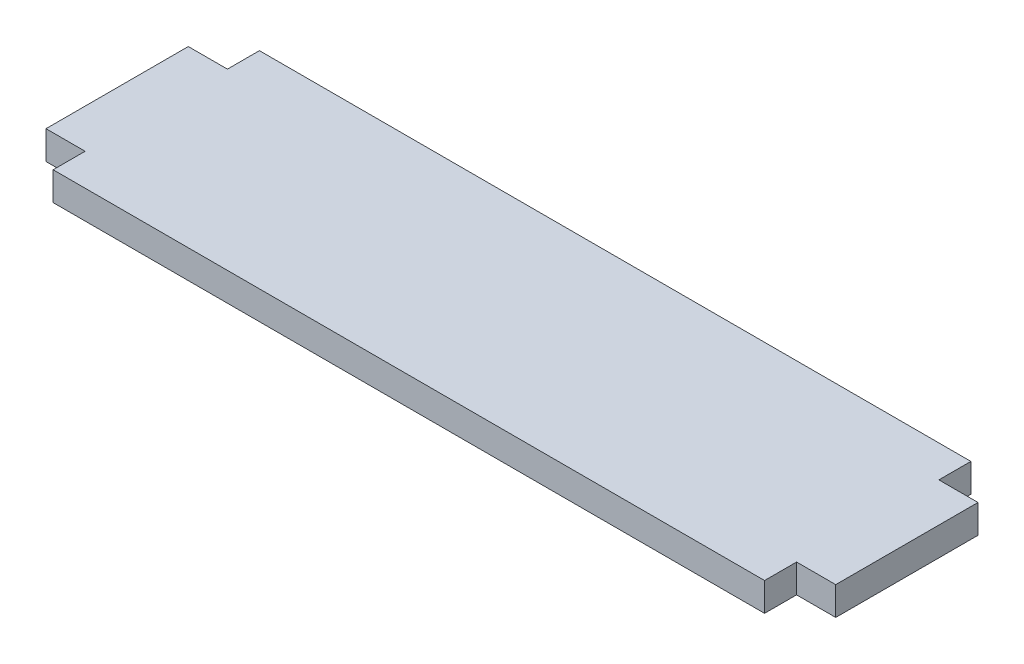
from build123d import *

# Parameters (mm, degrees)
SKETCH_1_W      = 99.99997774
SKETCH_1_H      = 28.996988848
EXTRUDE_1_DEPTH = 4
SKETCH_2_W      = 20
SKETCH_2_H      = 4
EXTRUDE_2_DEPTH = 5.5


with BuildPart() as part:
    # Эскиз1 → Бобышка-Вытянуть1 (new body)
    with BuildSketch(Plane(origin=(0, 0, 0), x_dir=(1, 0, 0), z_dir=(0, 1, 0))):
        Rectangle(SKETCH_1_W, SKETCH_1_H)
    extrude(amount=EXTRUDE_1_DEPTH)

    # Эскиз2 → Бобышка-Вытянуть2 (add)
    with BuildSketch(Plane(origin=(49.99998887, 0, 0), x_dir=(0, 0, -1), z_dir=(1, 0, 0))):
        with Locations((0, 2)):
            Rectangle(SKETCH_2_W, SKETCH_2_H)
    extrude_2 = extrude(amount=EXTRUDE_2_DEPTH)

    # Mirror1: Бобышка-Вытянуть2 across plane
    add(extrude_2.mirror(Plane(origin=(0, 0, 0), x_dir=(0, 0, 1), z_dir=(1, 0, 0))))


solid = part.part
